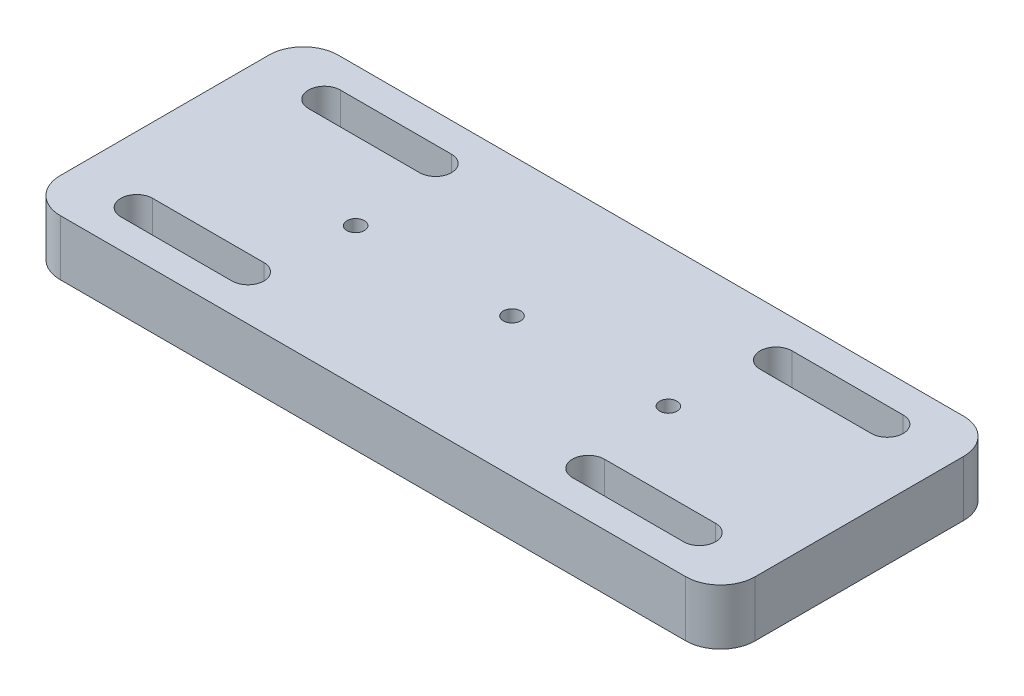
from build123d import *

# Parameters (mm, degrees)
SKETCH_1_W                       = 100
SKETCH_1_H                       = 40
EXTRUDE_1_DEPTH                  = 8
HOLE_WIZARD_M3_2_D               = 2.5
HOLE_WIZARD_M3_2_DEPTH           = 21.5
HOLE_WIZARD_M3_2_TIP             = 0.751075774
HOLE_WIZARD_M3_2_ON_FACE_2_D     = 2.5
HOLE_WIZARD_M3_2_ON_FACE_2_DEPTH = 21.5
HOLE_WIZARD_M3_2_ON_FACE_2_TIP   = 0.751075774
FILLET_1_R                       = 5


with BuildPart() as part:
    # 草图1 → 凸台-拉伸1 (new body)
    with BuildSketch(Plane(origin=(0, 0, 0), x_dir=(1, 0, 0), z_dir=(0, 1, 0))):
        Rectangle(SKETCH_1_W, SKETCH_1_H)
        with BuildLine():
            Line((-40.5, 15.8), (-24.5, 15.8))
            ThreePointArc((-24.5, 15.8), (-22.2, 13.5), (-24.5, 11.2))
            Line((-24.5, 11.2), (-40.5, 11.2))
            ThreePointArc((-40.5, 11.2), (-42.8, 13.5), (-40.5, 15.8))
        make_face(mode=Mode.SUBTRACT)
        with BuildLine():
            Line((-40.5, -11.2), (-24.5, -11.2))
            ThreePointArc((-24.5, -11.2), (-22.2, -13.5), (-24.5, -15.8))
            Line((-24.5, -15.8), (-40.5, -15.8))
            ThreePointArc((-40.5, -15.8), (-42.8, -13.5), (-40.5, -11.2))
        make_face(mode=Mode.SUBTRACT)
        with BuildLine():
            Line((40.5, 15.8), (24.5, 15.8))
            ThreePointArc((24.5, 15.8), (22.2, 13.5), (24.5, 11.2))
            Line((24.5, 11.2), (40.5, 11.2))
            ThreePointArc((40.5, 11.2), (42.8, 13.5), (40.5, 15.8))
        make_face(mode=Mode.SUBTRACT)
        with BuildLine():
            Line((40.5, -11.2), (24.5, -11.2))
            ThreePointArc((24.5, -11.2), (22.2, -13.5), (24.5, -15.8))
            Line((24.5, -15.8), (40.5, -15.8))
            ThreePointArc((40.5, -15.8), (42.8, -13.5), (40.5, -11.2))
        make_face(mode=Mode.SUBTRACT)
    extrude(amount=EXTRUDE_1_DEPTH)

    # M3 螺纹孔2
    with Locations(Plane(origin=(-22.5, 8, 0), x_dir=(0, 0, 1), z_dir=(0, 1, 0))):
        with Locations((0, 0), (0, 45), (0, 22.5)):
            Hole(HOLE_WIZARD_M3_2_D / 2, depth=HOLE_WIZARD_M3_2_DEPTH)
            with Locations((0, 0, -(HOLE_WIZARD_M3_2_DEPTH + HOLE_WIZARD_M3_2_TIP / 2))):  # 118° drill point
                Cone(0, HOLE_WIZARD_M3_2_D / 2, HOLE_WIZARD_M3_2_TIP, mode=Mode.SUBTRACT)

    # M3 螺纹孔2 on face 2
    with Locations(Plane(origin=(0, 0, 0), x_dir=(0, 0, -1), z_dir=(0, -1, 0))):
        with Locations((0, 0)):
            Hole(HOLE_WIZARD_M3_2_ON_FACE_2_D / 2, depth=HOLE_WIZARD_M3_2_ON_FACE_2_DEPTH)
            with Locations((0, 0, -(HOLE_WIZARD_M3_2_ON_FACE_2_DEPTH + HOLE_WIZARD_M3_2_ON_FACE_2_TIP / 2))):  # 118° drill point
                Cone(0, HOLE_WIZARD_M3_2_ON_FACE_2_D / 2, HOLE_WIZARD_M3_2_ON_FACE_2_TIP, mode=Mode.SUBTRACT)

    # 圆角1
    fillet_1_edges = [part.edges().sort_by_distance(p)[0] for p in [
        (50, 4, 20),
        (-50, 4, 20),
        (-50, 4, -20),
        (50, 4, -20),
    ]]
    fillet(fillet_1_edges, radius=FILLET_1_R)


solid = part.part
